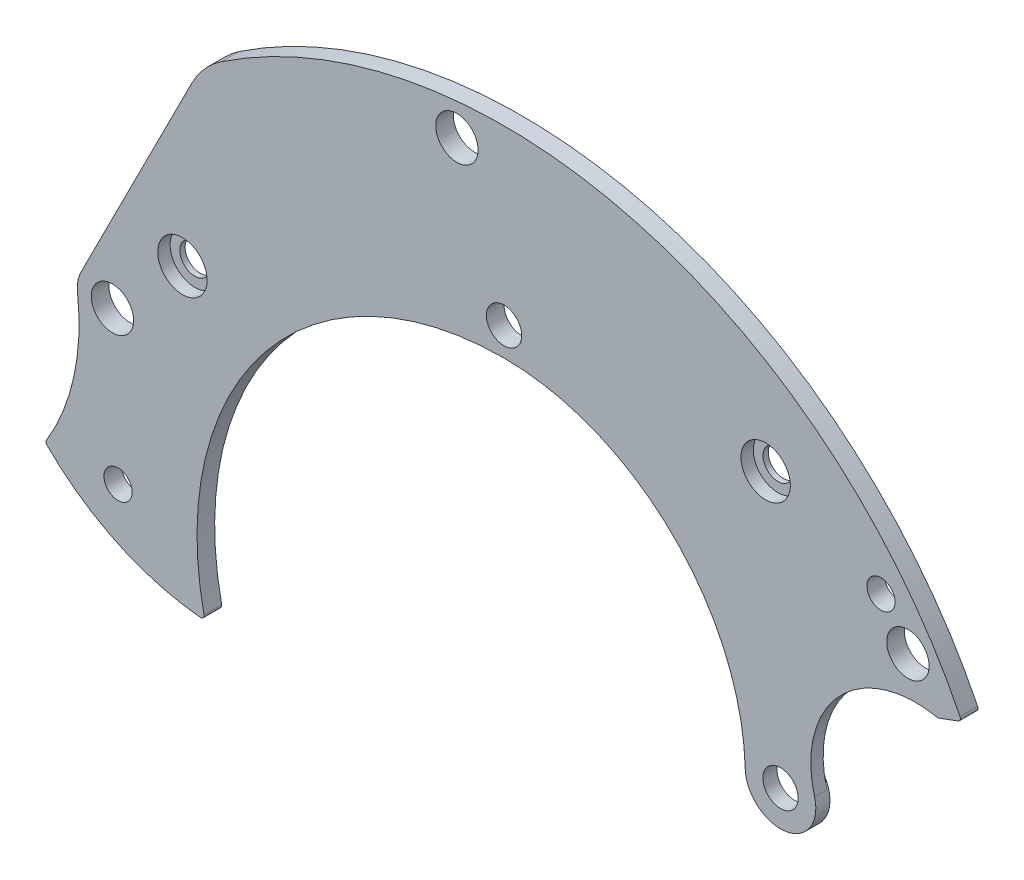
from build123d import *

# Parameters (mm, degrees)
SKETCH_1_R          = 0.5
SKETCH_1_R_2        = 0.4
SKETCH_1_R_3        = 0.425
EXTRUDE_1_DEPTH     = 0.5
SKETCH_2_R          = 4.472023715
CUT_EXTRUDE_1_DEPTH = 0.1
SKETCH_3_R          = 0.7
CUT_EXTRUDE_2_DEPTH = 0.35
SKETCH_4_R          = 4.472023715
SKETCH_4_R_2        = 1
CUT_EXTRUDE_3_DEPTH = 0.05
FILLET_1_R          = 0.1
SKETCH_5_R          = 0.6
CUT_EXTRUDE_4_DEPTH = 10


with BuildPart() as part:
    # Эскиз1 → Бобышка-Вытянуть1 (new body)
    with BuildSketch(Plane.XY):
        with BuildLine():
            Line((12.966197468, 6.264002172), (12.290985741, 6.014467613))
            ThreePointArc((12.290985741, 6.014467613), (9.503979032, 5.15824387), (8.79665468, 2.329778252))
            ThreePointArc((8.79665468, 2.329778252), (7.979149058, 1.075012683), (6.832886069, 2.038772631))
            ThreePointArc((6.832886069, 2.038772631), (4.771275566, 6.759132651), (0, 8.7))
            ThreePointArc((0, 8.7), (-6.815908497, 5.406791226), (-8.471768795, -1.979680148))
            ThreePointArc((-8.471768795, -1.979680148), (-10.930300525, -1.329835953), (-13.004676896, 0.141095189))
            ThreePointArc((-13.004676896, 0.141095189), (-12.194658567, 2.119542362), (-12.085233501, 4.254585469))
            ThreePointArc((-12.085233501, 4.254585469), (-12.076804664, 4.545349887), (-11.984771054, 4.821293371))
            Line((-11.984771054, 4.821293371), (-8.849528074, 11.018100783))
            ThreePointArc((-8.849528074, 11.018100783), (-8.490551174, 11.546729856), (-8.009291923, 11.967089993))
            ThreePointArc((-8.009291923, 11.967089993), (3.778098837, 13.895537743), (12.966197468, 6.264002172))
        make_face()
        with Locations((7.832562474, 2.064210526)):
            Circle(SKETCH_1_R, mode=Mode.SUBTRACT)
        with Locations((0, 9.5)):
            Circle(SKETCH_1_R, mode=Mode.SUBTRACT)
        with Locations((-10.935928421, 0.135601584)):
            Circle(SKETCH_1_R_2, mode=Mode.SUBTRACT)
        with Locations((-9.112495388, 6.401403857)):
            Circle(SKETCH_1_R_3, mode=Mode.SUBTRACT)
        with Locations((7.411343366, 9.626689996)):
            Circle(SKETCH_1_R_3, mode=Mode.SUBTRACT)
        with Locations((10.679257851, 8.251019039)):
            Circle(SKETCH_1_R_2, mode=Mode.SUBTRACT)
    extrude(amount=EXTRUDE_1_DEPTH)

    # Эскиз2 → Вырез-Вытянуть1 (cut)
    with BuildSketch(Plane(origin=(0, 0, 0), x_dir=(-1, 0, 0), z_dir=(0, 0, -1))):
        with Locations((-7.832562474, 2.064210526)):
            Circle(SKETCH_2_R)
    extrude(amount=-CUT_EXTRUDE_1_DEPTH, mode=Mode.SUBTRACT)

    # Эскиз3 → Вырез-Вытянуть2 (cut)
    with BuildSketch(Plane.XY.offset(0.5)):
        with Locations((-9.112495388, 6.401403857)):
            Circle(SKETCH_3_R)
        with Locations((7.411343366, 9.626689996)):
            Circle(SKETCH_3_R)
    extrude(amount=-CUT_EXTRUDE_2_DEPTH, mode=Mode.SUBTRACT)

    # Эскиз4 → Вырез-Вытянуть3 (cut)
    with BuildSketch(Plane(origin=(0, 0, 0.1), x_dir=(-1, 0, 0), z_dir=(0, 0, -1))):
        with Locations((-7.832562474, 2.064210526)):
            Circle(SKETCH_4_R)
        with Locations((-7.832562474, 2.064210526)):
            Circle(SKETCH_4_R_2, mode=Mode.SUBTRACT)
    extrude(amount=-CUT_EXTRUDE_3_DEPTH, mode=Mode.SUBTRACT)

    # Скругление1
    fillet_1_edges = [part.edges().sort_by_distance(p)[0] for p in [
        (12.966197468, 6.264002172, 0.25),
        (12.290985741, 6.014467613, 0.25),
        (-8.471768795, -1.979680148, 0.25),
        (-13.004676896, 0.141095189, 0.25),
        (10.333057023, 5.771840917, 0.075),
        (5.521987637, 5.893079815, 0.075),
    ]]
    fillet(fillet_1_edges, radius=FILLET_1_R)

    # Эскиз5 → Вырез-Вытянуть4 (cut)
    with BuildSketch(Plane.XY.offset(0.5)):
        with Locations((-11.09555803, 4.371400595)):
            Circle(SKETCH_5_R)
        with Locations((11.442307716, 7.164048725)):
            Circle(SKETCH_5_R)
        with Locations((-1.336244315, 13.433705785)):
            Circle(SKETCH_5_R)
    extrude(amount=-CUT_EXTRUDE_4_DEPTH, mode=Mode.SUBTRACT)


solid = part.part
